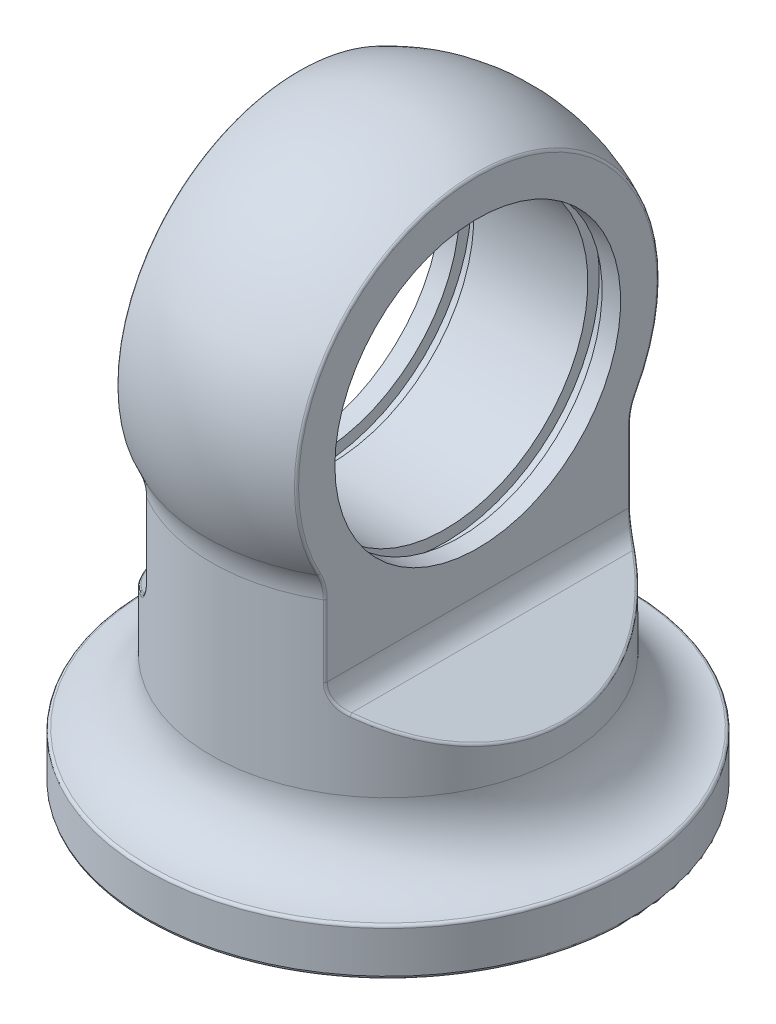
from build123d import *

# Parameters (mm, degrees)
CUT_EXTRUDE1_DEPTH = 61.966444909
FILLET2_R          = 2.54
FILLET1_R          = 0.254


with BuildPart() as part:
    # Sketch11 → Revolve2 (revolve)
    with BuildSketch(Plane.XY, mode=Mode.PRIVATE) as revolve2_sk:
        with BuildLine():
            Line((0, 20.32), (6.985, 16.122988576))
            Line((6.985, 16.122988576), (6.985, 0))
            Line((6.985, 0), (21.5138, 0))
            Line((21.5138, 0), (21.5138, 4.191))
            ThreePointArc((21.5138, 4.191), (17.436763721, 5.879763721), (15.748, 9.9568))
            Line((15.748, 9.9568), (15.748, 24.859572123))
            ThreePointArc((15.748, 24.859572123), (15.873905695, 25.983560386), (16.245381738, 27.051833482))
            ThreePointArc((16.245381738, 27.051833482), (15.235890305, 44.424302071), (0, 52.832))
            Line((0, 52.832), (0, 20.32))
        make_face()
    revolve(revolve2_sk.sketch.rotate(Axis((0, -7.745349934, 0), (0, 1, 0)), 90), axis=Axis((0, -7.745349934, 0), (0, 1, 0)))

    # Sketch8 → Cut-Extrude1 (cut, symmetric)
    with BuildSketch(Plane.XY):
        Polygon((8.001, 52.832), (8.001, 17.018), (18.0086, 11.240109446), (18.0086, 52.832), align=None)
    cut_extrude1 = extrude(amount=CUT_EXTRUDE1_DEPTH, both=True, mode=Mode.SUBTRACT)

    # Mirror1: Cut-Extrude1 across plane
    add(cut_extrude1.mirror(Plane(origin=(0, 0, 0), x_dir=(0, 0, 1), z_dir=(1, 0, 0))), mode=Mode.SUBTRACT)

    # Sketch12 → Cut-Revolve1 (revolve, cut)
    with BuildSketch(Plane.XY, mode=Mode.PRIVATE) as cut_revolve1_sk:
        Polygon((-8.001, 34.8234), (-8.001, 47.5615), (-6.35, 47.5615), (-6.35, 48.5775), (-5.08, 48.5775), (-5.08, 47.5615), (5.08, 47.5615), (5.08, 48.5775), (6.35, 48.5775), (6.35, 47.5615), (8.001, 47.5615), (8.001, 34.8234), align=None)
    revolve(cut_revolve1_sk.sketch.rotate(Axis((-22.453545283, 34.8234, 0), (1, 0, 0)), 90), axis=Axis((-22.453545283, 34.8234, 0), (1, 0, 0)), mode=Mode.SUBTRACT)

    # Fillet2
    fillet2_edges = [part.edges().sort_by_distance(p)[0] for p in [
        (-8.001, 17.018, 0),
        (8.001, 17.018, 0),
    ]]
    fillet(fillet2_edges, radius=FILLET2_R)

    # Fillet1
    fillet1_edges = [part.edges().sort_by_distance(p)[0] for p in [
        (8.001, 21.672020903, 13.564051865),
        (8.001, 25.991940719, -13.712238497),
        (8.001, 50.957019339, 0),
        (8.001, 25.991940719, 13.712238497),
        (-8.001, 21.672020903, 13.564051865),
        (-8.001, 25.991940719, -13.712238497),
        (-8.001, 50.957019339, 0),
        (-8.001, 25.991940719, 13.712238497),
        (-8.001, 21.672020903, -13.564051865),
        (-15.748, 12.545267465, 0),
        (15.748, 12.545267465, 0),
        (8.001, 21.672020903, -13.564051865),
        (-8.371349216, 17.163782176, 13.338666215),
        (-8.371349216, 17.163782176, -13.338666215),
        (8.371349216, 17.163782176, 13.338666215),
        (8.371349216, 17.163782176, -13.338666215),
        (0, 0, 21.5138),
        (0, 4.191, 21.5138),
    ]]
    fillet(fillet1_edges, radius=FILLET1_R)


solid = part.part
